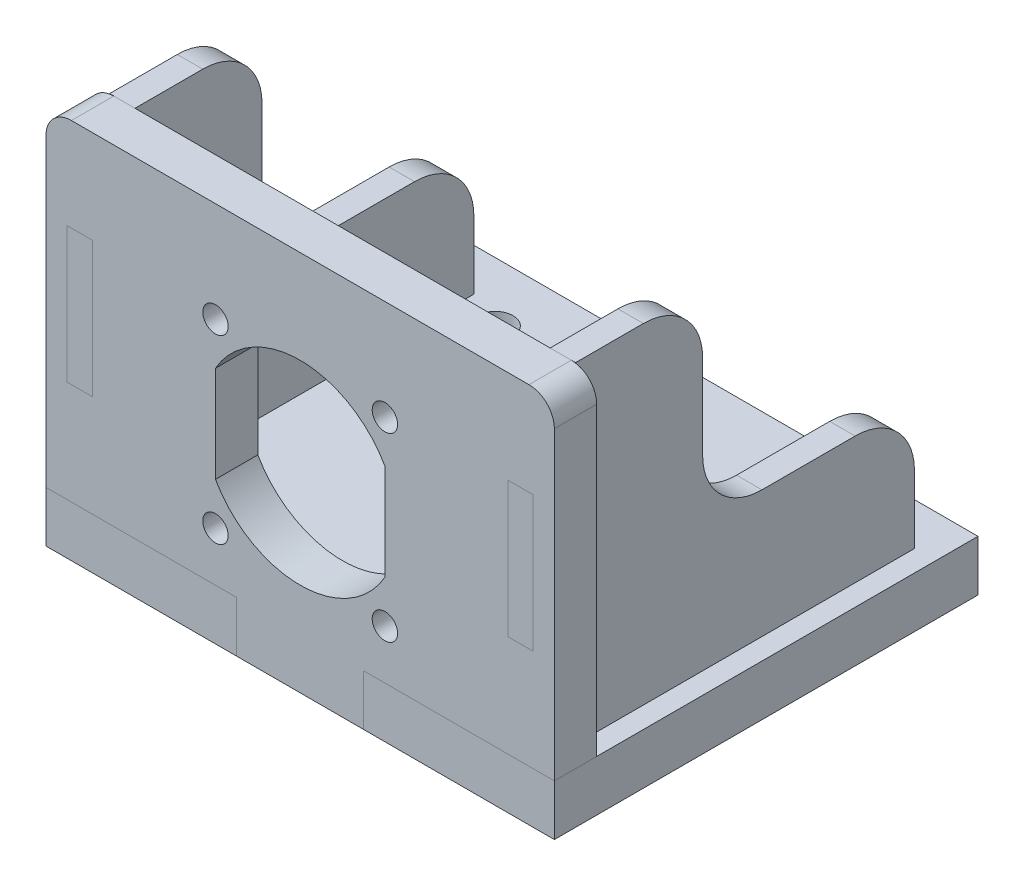
from build123d import *

# Parameters (mm, degrees)
SKETCH1_R           = 2.113879082
SKETCH1_W           = 3
SKETCH1_H           = 16
BASE_PART_DEPTH     = 6
SKETCH2_R           = 1.5
SKETCH2_W           = 3
SKETCH2_H           = 16
VERTICAL_PART_DEPTH = 5
SIDE_PART_DEPTH     = 3
LPATTERN1_COUNT     = 2
LPATTERN1_PITCH     = 52


with BuildPart() as part:
    # Sketch1 → Base Part (new body)
    with BuildSketch(Plane(origin=(0, 0, 0), x_dir=(1, 0, 0), z_dir=(0, 1, 0))):
        Polygon((0, 0), (0, 50), (60, 50), (60, 0), (37.5, 0), (37.5, 5), (22.5, 5), (22.5, 0), align=None)
        with Locations(Location((10, 12, 0), (0, 0, 270))):
            Circle(SKETCH1_R, mode=Mode.SUBTRACT)
        with Locations(Location((50, 12, 0), (0, 0, 90))):
            Circle(SKETCH1_R, mode=Mode.SUBTRACT)
        with Locations(Location((50, 43, 0), (0, 0, 90))):
            Circle(SKETCH1_R, mode=Mode.SUBTRACT)
        with Locations(Location((10, 43, 0), (0, 0, 270))):
            Circle(SKETCH1_R, mode=Mode.SUBTRACT)
        with Locations((4, 26)):
            Rectangle(SKETCH1_W, SKETCH1_H, mode=Mode.SUBTRACT)
        with Locations((56, 26)):
            Rectangle(SKETCH1_W, SKETCH1_H, mode=Mode.SUBTRACT)
    extrude(amount=BASE_PART_DEPTH)


with BuildPart() as body_2:
    # Sketch2 → Vertical Part (new body)
    with BuildSketch(Plane.XY):
        with BuildLine():
            Line((0, 6), (22.5, 6))
            Line((22.5, 6), (22.5, 0))
            Line((22.5, 0), (37.5, 0))
            Line((37.5, 0), (37.5, 6))
            Line((37.5, 6), (60, 6))
            Line((60, 6), (60, 42))
            ThreePointArc((60, 42), (59.121320344, 44.121320344), (57, 45))
            Line((57, 45), (3, 45))
            ThreePointArc((3, 45), (0.878679656, 44.121320344), (0, 42))
            Line((0, 42), (0, 6))
        make_face()
        with Locations((20, 33.178908346)):
            Circle(SKETCH2_R, mode=Mode.SUBTRACT)
        with Locations(Location((40, 33.178908346, 0), (0, 0, 180))):
            Circle(SKETCH2_R, mode=Mode.SUBTRACT)
        with Locations((40, 11.821091654)):
            Circle(SKETCH2_R, mode=Mode.SUBTRACT)
        with Locations(Location((20, 11.821091654, 0), (0, 0, 180))):
            Circle(SKETCH2_R, mode=Mode.SUBTRACT)
        with BuildLine():
            Line((20, 28.178908346), (20, 16.821091654))
            ThreePointArc((20, 16.821091654), (30, 11), (40, 16.821091654))
            Line((40, 16.821091654), (40, 28.178908346))
            ThreePointArc((40, 28.178908346), (30, 34), (20, 28.178908346))
        make_face(mode=Mode.SUBTRACT)
        with Locations((4, 26)):
            Rectangle(SKETCH2_W, SKETCH2_H, mode=Mode.SUBTRACT)
        with Locations((56, 26)):
            Rectangle(SKETCH2_W, SKETCH2_H, mode=Mode.SUBTRACT)
    extrude(amount=-VERTICAL_PART_DEPTH)


with BuildPart() as body_3:
    # Sketch3 → Side Part (new body)
    with BuildSketch(Plane.ZY.offset(-2.5)):
        with BuildLine():
            Line((-38, 21), (-27, 21))
            ThreePointArc((-27, 21), (-22.050252532, 23.050252532), (-20, 28))
            Line((-20, 28), (-20, 38))
            ThreePointArc((-20, 38), (-17.949747468, 42.949747468), (-13, 45))
            Line((-13, 45), (-5, 45))
            Line((-5, 45), (-5, 34))
            Line((-5, 34), (0, 34))
            Line((0, 34), (0, 18))
            Line((0, 18), (-5, 18))
            Line((-5, 18), (-5, 6))
            Line((-5, 6), (-18, 6))
            Line((-18, 6), (-18, 0))
            Line((-18, 0), (-34, 0))
            Line((-34, 0), (-34, 6))
            Line((-34, 6), (-45, 6))
            Line((-45, 6), (-45, 14))
            ThreePointArc((-45, 14), (-42.949747468, 18.949747468), (-38, 21))
        make_face()
    side_part = extrude(amount=-SIDE_PART_DEPTH)


with BuildPart() as lpattern1_1:
    # LPattern1: Side Part ×2
    with Locations(*[(i * LPATTERN1_PITCH, 0, 0) for i in range(1, LPATTERN1_COUNT)]):
        add(side_part)


solid = Compound([part.part, body_2.part, body_3.part, lpattern1_1.part])
